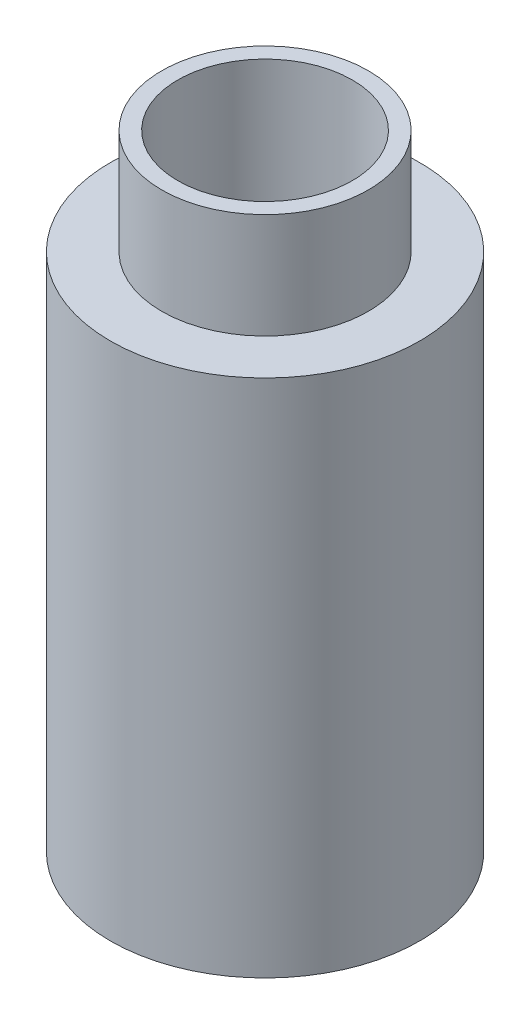
from build123d import *

# Parameters (mm, degrees)
SKETCH1_R           = 9.4488
BOSS_EXTRUDE1_DEPTH = 31.75
SKETCH2_R           = 6.3119
BOSS_EXTRUDE2_DEPTH = 6.4262
SKETCH3_R           = 5.334
CUT_EXTRUDE1_DEPTH  = 41.447272953


with BuildPart() as part:
    # Sketch1 → Boss-Extrude1 (new body)
    with BuildSketch(Plane(origin=(0, 0, 0), x_dir=(1, 0, 0), z_dir=(0, 1, 0))):
        with Locations(Location((0, 0, 0), (0, 0, 270))):
            Circle(SKETCH1_R)
    extrude(amount=BOSS_EXTRUDE1_DEPTH)

    # Sketch2 → Boss-Extrude2 (add)
    with BuildSketch(Plane(origin=(0, 31.75, 0), x_dir=(1, 0, 0), z_dir=(0, 1, 0))):
        with Locations(Location((0, 0, 0), (0, 0, 270))):
            Circle(SKETCH2_R)
    extrude(amount=BOSS_EXTRUDE2_DEPTH)

    # Sketch3 → Cut-Extrude1 (cut, through all)
    with BuildSketch(Plane(origin=(0, 38.1762, 0), x_dir=(1, 0, 0), z_dir=(0, 1, 0))):
        with Locations(Location((0, 0, 0), (0, 0, 270))):
            Circle(SKETCH3_R)
    extrude(amount=-CUT_EXTRUDE1_DEPTH, mode=Mode.SUBTRACT)


solid = part.part
